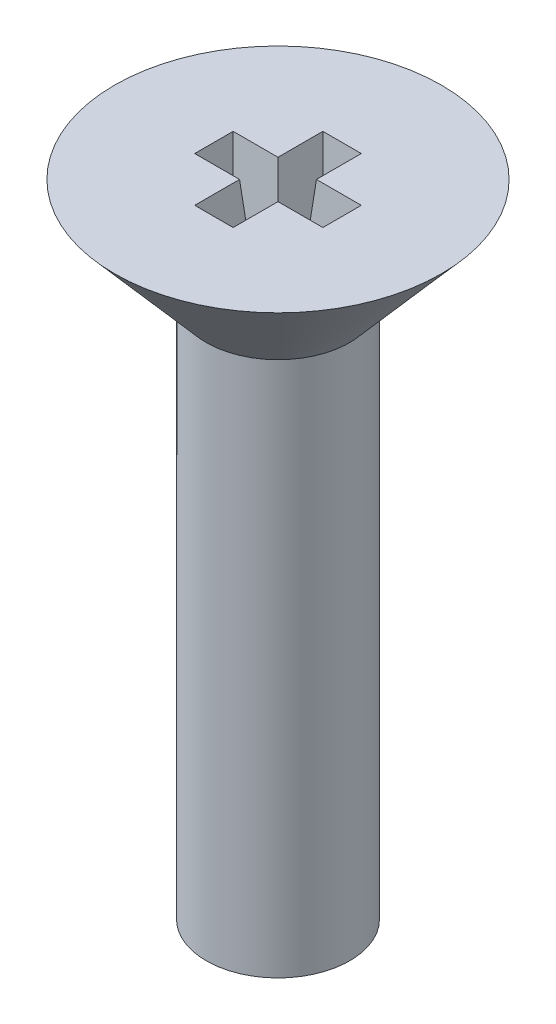
from build123d import *

# Parameters (mm, degrees)
CUT_EXTRUDE1_DEPTH = 2.159
CUT_EXTRUDE1_DRAFT = -5


with BuildPart() as part:
    # Sketch1 → Revolve1 (revolve)
    with BuildSketch(Plane.XY, mode=Mode.PRIVATE) as revolve1_sk:
        Polygon((1.4224, 0), (3.2385, 2.089184064), (0, 2.089184064), (0, 0), (0, -10.610815936), (1.4224, -10.610815936), align=None)
    revolve(revolve1_sk.sketch.rotate(Axis((0, 0, 0), (0, -1, 0)), 180), axis=Axis((0, 0, 0), (0, -1, 0)))


with BuildPart() as cut_extrude1_tool:
    # Sketch2 → Cut-Extrude1 (with draft: the straight prism first)
    with BuildSketch(Plane(origin=(0, 2.089184064, 0), x_dir=(1, 0, 0), z_dir=(0, 1, 0))):
        Polygon((-0.381, 1.27), (-0.381, 0.381), (-1.27, 0.381), (-1.27, -0.381), (-0.381, -0.381), (-0.381, -1.27), (0.381, -1.27), (0.381, -0.381), (1.27, -0.381), (1.27, 0.381), (0.381, 0.381), (0.381, 1.27), align=None)
    extrude(amount=-CUT_EXTRUDE1_DEPTH)
    # Cut-Extrude1: the draft: its side faces are tilted about the plane it starts from
    cut_extrude1_sides = [cut_extrude1_tool.faces().sort_by_distance(p)[0] for p in [
        (-0.381, 1.009684064, -0.8255),
        (-0.8255, 1.009684064, -0.381),
        (-1.27, 1.009684064, 0),
        (-0.8255, 1.009684064, 0.381),
        (-0.381, 1.009684064, 0.8255),
        (0, 1.009684064, 1.27),
        (0.381, 1.009684064, 0.8255),
        (0.8255, 1.009684064, 0.381),
        (1.27, 1.009684064, 0),
        (0.8255, 1.009684064, -0.381),
        (0.381, 1.009684064, -0.8255),
        (0, 1.009684064, -1.27),
    ]]
    draft(cut_extrude1_sides, Plane(origin=(0, 2.089184064, 0), x_dir=(1, 0, 0), z_dir=(0, 1, 0)), CUT_EXTRUDE1_DRAFT)


with BuildPart() as part_1:
    add(part.part)

    # Cut-Extrude1: cut by cut_extrude1_tool
    add(cut_extrude1_tool.part, mode=Mode.SUBTRACT)


solid = part_1.part
